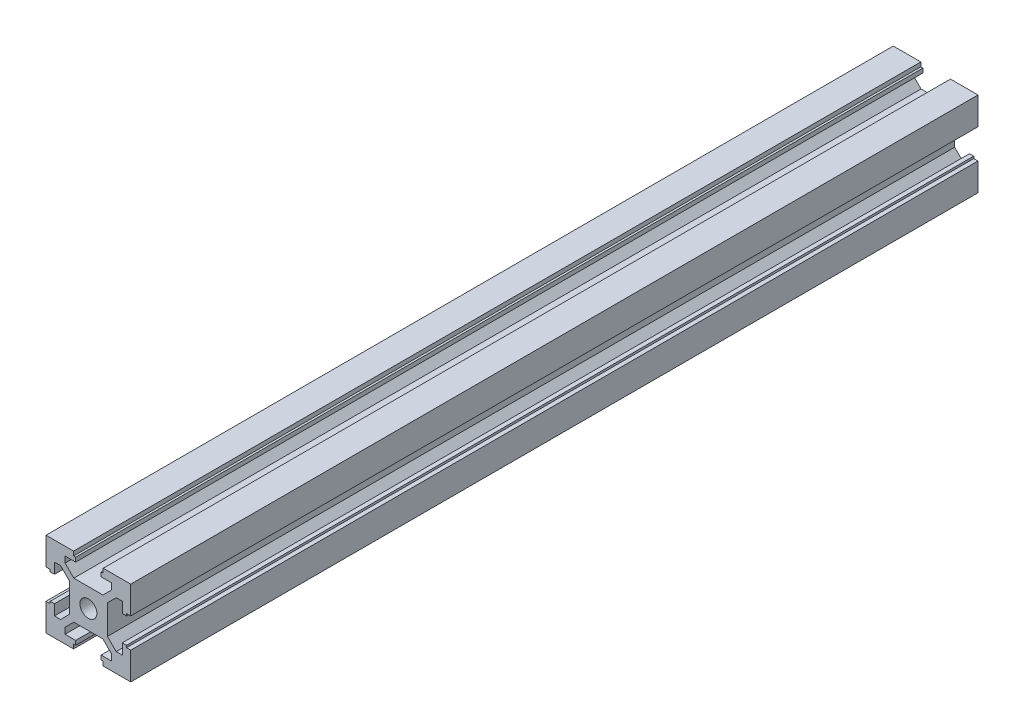
from build123d import *

# Parameters (mm, degrees)
SKETCH1_R           = 2
BOSS_EXTRUDE1_DEPTH = 200


with BuildPart() as part:
    # Sketch1 → Boss-Extrude1 (new body)
    with BuildSketch(Plane.XY):
        Polygon((-10, -10), (-3.5, -10), (-3.5, -9), (-3, -9), (-3, -8), (-5.5, -8), (-5.5, -6.560660172), (-3.44, -4.500660172), (3.44, -4.500660172), (5.5, -6.560660172), (5.5, -8), (3, -8), (3, -9), (3.5, -9), (3.5, -10), (10, -10), (10, -3.5), (9, -3.5), (9, -3), (8, -3), (8, -5.5), (6.560660172, -5.5), (4.500660172, -3.44), (4.500660172, 3.44), (6.560660172, 5.5), (8, 5.5), (8, 3), (9, 3), (9, 3.5), (10, 3.5), (10, 10), (3.5, 10), (3.5, 9), (3, 9), (3, 8), (5.5, 8), (5.5, 6.560660172), (3.44, 4.500660172), (-3.44, 4.500660172), (-5.5, 6.560660172), (-5.5, 8), (-3, 8), (-3, 9), (-3.5, 9), (-3.5, 10), (-10, 10), (-10, 3.5), (-9, 3.5), (-9, 3), (-8, 3), (-8, 5.5), (-6.560660172, 5.5), (-4.500660172, 3.44), (-4.500660172, -3.44), (-6.560660172, -5.5), (-8, -5.5), (-8, -3), (-9, -3), (-9, -3.5), (-10, -3.5), align=None)
        Circle(SKETCH1_R, mode=Mode.SUBTRACT)
    extrude(amount=BOSS_EXTRUDE1_DEPTH)


solid = part.part
